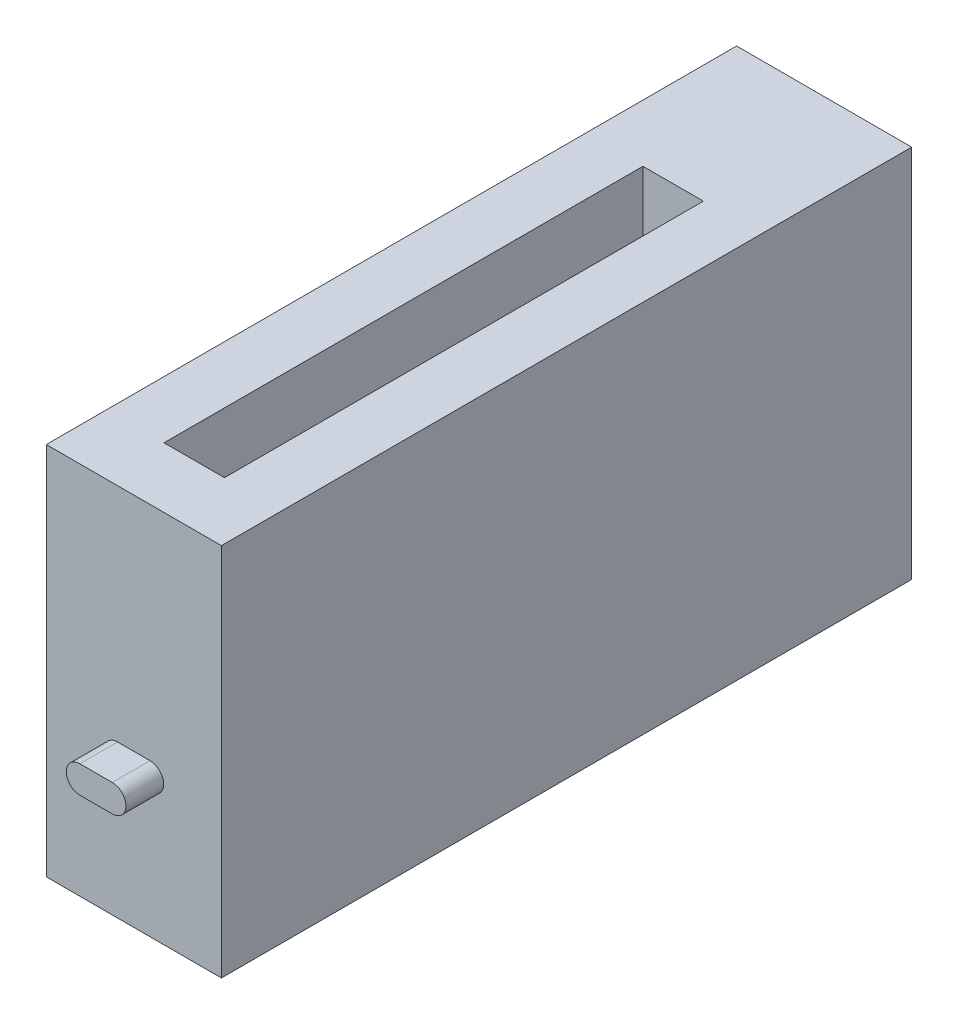
from build123d import *

# Parameters (mm, degrees)
SKETCH1_W           = 7.366
SKETCH1_H           = 29.0322
BOSS_EXTRUDE1_DEPTH = 15.748
SKETCH2_W           = 2.54
SKETCH2_H           = 20.1422
CUT_EXTRUDE1_DEPTH  = 3.175
BOSS_EXTRUDE3_DEPTH = 1.5875


with BuildPart() as part:
    # Sketch1 → Boss-Extrude1 (new body)
    with BuildSketch(Plane(origin=(0, 0, 0), x_dir=(1, 0, 0), z_dir=(0, 1, 0))):
        Rectangle(SKETCH1_W, SKETCH1_H)
    extrude(amount=BOSS_EXTRUDE1_DEPTH)

    # Sketch2 → Cut-Extrude1 (cut)
    with BuildSketch(Plane(origin=(0, 15.748, 0), x_dir=(1, 0, 0), z_dir=(0, 1, 0))):
        with Locations((0, -1.905)):
            Rectangle(SKETCH2_W, SKETCH2_H)
    extrude(amount=-CUT_EXTRUDE1_DEPTH, mode=Mode.SUBTRACT)

    # Sketch5 → Boss-Extrude3 (add)
    with BuildSketch(Plane.XY.offset(14.5161)):
        with BuildLine():
            Line((-0.682666257, 6.414003725), (0.682666257, 6.414003725))
            ThreePointArc((0.682666257, 6.414003725), (1.254669982, 5.842), (0.682666257, 5.269996275))
            Line((0.682666257, 5.269996275), (-0.682666257, 5.269996275))
            ThreePointArc((-0.682666257, 5.269996275), (-1.254669982, 5.842), (-0.682666257, 6.414003725))
        make_face()
    extrude(amount=BOSS_EXTRUDE3_DEPTH)


solid = part.part
